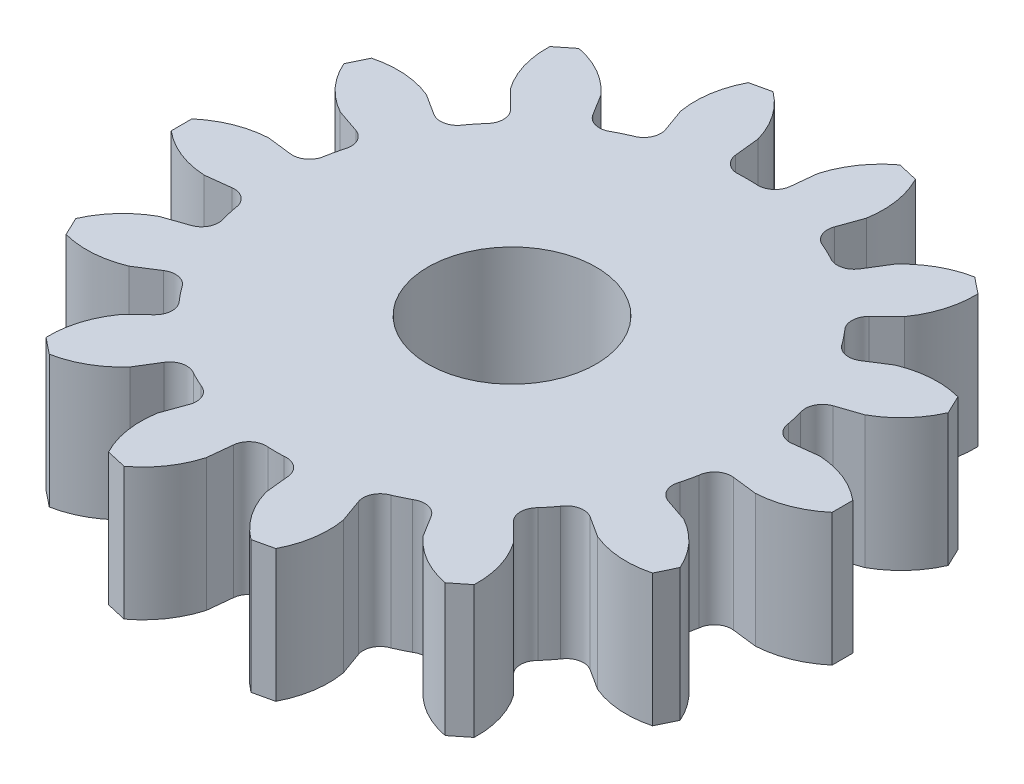
from build123d import *

# Parameters (mm, degrees)
SKETCH1_R           = 2.542419914
BOSS_EXTRUDE1_DEPTH = 3.999992


with BuildPart() as part:
    # Sketch1 → Boss-Extrude1 (new body)
    with BuildSketch(Plane(origin=(0, 0, 0), x_dir=(1, 0, 0), z_dir=(0, 1, 0))):
        with BuildLine():
            Line((-7.927115113, 2.735422797), (-7.212976361, 2.491621041))
            ThreePointArc((-7.212976361, 2.491621041), (-6.913293064, 2.224424018), (-6.895509083, 1.823315483))
            ThreePointArc((-6.895509083, 1.823315483), (-6.953671189, 1.587130072), (-7.003745952, 1.349098778))
            ThreePointArc((-7.003745952, 1.349098778), (-7.193803236, 0.995428655), (-7.579741, 0.884720165))
            Line((-7.579741, 0.884720165), (-8.3289394, 0.974915565))
            ThreePointArc((-8.3289394, 0.974915565), (-9.212212433, 0.780173764), (-9.9866958, 0.3129788))
            Line((-9.9866958, 0.3129788), (-9.9866958, -0.3129788))
            ThreePointArc((-9.9866958, -0.3129788), (-9.212212433, -0.780173764), (-8.3289394, -0.974915565))
            Line((-8.3289394, -0.974915565), (-7.579741, -0.884720165))
            ThreePointArc((-7.579741, -0.884720165), (-7.193803236, -0.995428655), (-7.003745952, -1.349098778))
            ThreePointArc((-7.003745952, -1.349098778), (-6.953671189, -1.587130072), (-6.895509083, -1.823315483))
            ThreePointArc((-6.895509083, -1.823315483), (-6.913293064, -2.224424018), (-7.212976361, -2.491621041))
            Line((-7.212976361, -2.491621041), (-7.927115113, -2.735422797))
            ThreePointArc((-7.927115113, -2.735422797), (-8.638421316, -3.294116903), (-9.133498421, -4.05108076))
            Line((-9.133498421, -4.05108076), (-8.861905597, -4.61504907))
            ThreePointArc((-8.861905597, -4.61504907), (-7.961411897, -4.699941449), (-7.081115091, -4.492159943))
            Line((-7.081115091, -4.492159943), (-6.445244975, -4.085831692))
            ThreePointArc((-6.445244975, -4.085831692), (-6.049492451, -4.018124475), (-5.724805039, -4.25430748))
            ThreePointArc((-5.724805039, -4.25430748), (-5.576411329, -4.44703964), (-5.421532073, -4.63459975))
            ThreePointArc((-5.421532073, -4.63459975), (-5.263520415, -5.003702234), (-5.417593292, -5.374466142))
            Line((-5.417593292, -5.374466142), (-5.955228458, -5.903977126))
            ThreePointArc((-5.955228458, -5.903977126), (-6.353684915, -6.715967318), (-6.471299665, -7.612774092))
            Line((-6.471299665, -7.612774092), (-5.981906306, -8.003052272))
            ThreePointArc((-5.981906306, -8.003052272), (-5.133756094, -7.688828089), (-4.430789095, -7.119676951))
            Line((-4.430789095, -7.119676951), (-4.034189136, -6.477694143))
            ThreePointArc((-4.034189136, -6.477694143), (-3.707005493, -6.244981464), (-3.311996278, -6.31689841))
            ThreePointArc((-3.311996278, -6.31689841), (-3.094674815, -6.426158468), (-2.873754145, -6.527944698))
            ThreePointArc((-2.873754145, -6.527944698), (-2.571242995, -6.791935856), (-2.54918943, -7.192832311))
            Line((-2.54918943, -7.192832311), (-2.80383577, -7.903176378))
            ThreePointArc((-2.80383577, -7.903176378), (-2.810523293, -8.807638039), (-2.527380645, -9.666664151))
            Line((-2.527380645, -9.666664151), (-1.917117109, -9.805952821))
            ThreePointArc((-1.917117109, -9.805952821), (-1.289296936, -9.154848028), (-0.902890978, -8.337054622))
            Line((-0.902890978, -8.337054622), (-0.824112663, -7.586569825))
            ThreePointArc((-0.824112663, -7.586569825), (-0.630300635, -7.234943284), (-0.243206036, -7.128350138))
            ThreePointArc((-0.243206036, -7.128350138), (0, -7.1324978), (0.243206036, -7.128350138))
            ThreePointArc((0.243206036, -7.128350138), (0.630300635, -7.234943284), (0.824112663, -7.586569825))
            Line((0.824112663, -7.586569825), (0.902890978, -8.337054622))
            ThreePointArc((0.902890978, -8.337054622), (1.289296936, -9.154848028), (1.917117109, -9.805952821))
            Line((1.917117109, -9.805952821), (2.527380645, -9.666664151))
            ThreePointArc((2.527380645, -9.666664151), (2.810523293, -8.807638039), (2.80383577, -7.903176378))
            Line((2.80383577, -7.903176378), (2.54918943, -7.192832311))
            ThreePointArc((2.54918943, -7.192832311), (2.571242995, -6.791935856), (2.873754145, -6.527944698))
            ThreePointArc((2.873754145, -6.527944698), (3.094674815, -6.426158468), (3.311996278, -6.31689841))
            ThreePointArc((3.311996278, -6.31689841), (3.707005493, -6.244981464), (4.034189136, -6.477694143))
            Line((4.034189136, -6.477694143), (4.430789095, -7.119676951))
            ThreePointArc((4.430789095, -7.119676951), (5.133756094, -7.688828089), (5.981906306, -8.003052272))
            Line((5.981906306, -8.003052272), (6.471299665, -7.612774092))
            ThreePointArc((6.471299665, -7.612774092), (6.353684915, -6.715967318), (5.955228458, -5.903977126))
            Line((5.955228458, -5.903977126), (5.417593292, -5.374466142))
            ThreePointArc((5.417593292, -5.374466142), (5.263520415, -5.003702234), (5.421532073, -4.63459975))
            ThreePointArc((5.421532073, -4.63459975), (5.576411329, -4.44703964), (5.724805039, -4.25430748))
            ThreePointArc((5.724805039, -4.25430748), (6.049492451, -4.018124475), (6.445244975, -4.085831692))
            Line((6.445244975, -4.085831692), (7.081115091, -4.492159943))
            ThreePointArc((7.081115091, -4.492159943), (7.961411897, -4.699941449), (8.861905597, -4.61504907))
            Line((8.861905597, -4.61504907), (9.133498421, -4.05108076))
            ThreePointArc((9.133498421, -4.05108076), (8.638421316, -3.294116903), (7.927115113, -2.735422797))
            Line((7.927115113, -2.735422797), (7.212976361, -2.491621041))
            ThreePointArc((7.212976361, -2.491621041), (6.913293064, -2.224424018), (6.895509083, -1.823315483))
            ThreePointArc((6.895509083, -1.823315483), (6.953671189, -1.587130072), (7.003745952, -1.349098778))
            ThreePointArc((7.003745952, -1.349098778), (7.193803236, -0.995428655), (7.579741, -0.884720165))
            Line((7.579741, -0.884720165), (8.3289394, -0.974915565))
            ThreePointArc((8.3289394, -0.974915565), (9.212212433, -0.780173764), (9.9866958, -0.3129788))
            Line((9.9866958, -0.3129788), (9.9866958, 0.3129788))
            ThreePointArc((9.9866958, 0.3129788), (9.212212433, 0.780173764), (8.3289394, 0.974915565))
            Line((8.3289394, 0.974915565), (7.579741, 0.884720165))
            ThreePointArc((7.579741, 0.884720165), (7.193803236, 0.995428655), (7.003745952, 1.349098778))
            ThreePointArc((7.003745952, 1.349098778), (6.953671189, 1.587130072), (6.895509083, 1.823315483))
            ThreePointArc((6.895509083, 1.823315483), (6.913293064, 2.224424018), (7.212976361, 2.491621041))
            Line((7.212976361, 2.491621041), (7.927115113, 2.735422797))
            ThreePointArc((7.927115113, 2.735422797), (8.638421316, 3.294116903), (9.133498421, 4.05108076))
            Line((9.133498421, 4.05108076), (8.861905597, 4.61504907))
            ThreePointArc((8.861905597, 4.61504907), (7.961411897, 4.699941449), (7.081115091, 4.492159943))
            Line((7.081115091, 4.492159943), (6.445244975, 4.085831692))
            ThreePointArc((6.445244975, 4.085831692), (6.049492451, 4.018124475), (5.724805039, 4.25430748))
            ThreePointArc((5.724805039, 4.25430748), (5.576411329, 4.44703964), (5.421532073, 4.63459975))
            ThreePointArc((5.421532073, 4.63459975), (5.263520415, 5.003702234), (5.417593292, 5.374466142))
            Line((5.417593292, 5.374466142), (5.955228458, 5.903977126))
            ThreePointArc((5.955228458, 5.903977126), (6.353684915, 6.715967318), (6.471299665, 7.612774092))
            Line((6.471299665, 7.612774092), (5.981906306, 8.003052272))
            ThreePointArc((5.981906306, 8.003052272), (5.133756094, 7.688828089), (4.430789095, 7.119676951))
            Line((4.430789095, 7.119676951), (4.034189136, 6.477694143))
            ThreePointArc((4.034189136, 6.477694143), (3.707005493, 6.244981464), (3.311996278, 6.31689841))
            ThreePointArc((3.311996278, 6.31689841), (3.094674815, 6.426158468), (2.873754145, 6.527944698))
            ThreePointArc((2.873754145, 6.527944698), (2.571242995, 6.791935856), (2.54918943, 7.192832311))
            Line((2.54918943, 7.192832311), (2.80383577, 7.903176378))
            ThreePointArc((2.80383577, 7.903176378), (2.810523293, 8.807638039), (2.527380645, 9.666664151))
            Line((2.527380645, 9.666664151), (1.917117109, 9.805952821))
            ThreePointArc((1.917117109, 9.805952821), (1.289296936, 9.154848028), (0.902890978, 8.337054622))
            Line((0.902890978, 8.337054622), (0.824112663, 7.586569825))
            ThreePointArc((0.824112663, 7.586569825), (0.630300635, 7.234943284), (0.243206036, 7.128350138))
            ThreePointArc((0.243206036, 7.128350138), (0, 7.1324978), (-0.243206036, 7.128350138))
            ThreePointArc((-0.243206036, 7.128350138), (-0.630300635, 7.234943284), (-0.824112663, 7.586569825))
            Line((-0.824112663, 7.586569825), (-0.902890978, 8.337054622))
            ThreePointArc((-0.902890978, 8.337054622), (-1.289296936, 9.154848028), (-1.917117109, 9.805952821))
            Line((-1.917117109, 9.805952821), (-2.527380645, 9.666664151))
            ThreePointArc((-2.527380645, 9.666664151), (-2.810523293, 8.807638039), (-2.80383577, 7.903176378))
            Line((-2.80383577, 7.903176378), (-2.54918943, 7.192832311))
            ThreePointArc((-2.54918943, 7.192832311), (-2.571242995, 6.791935856), (-2.873754145, 6.527944698))
            ThreePointArc((-2.873754145, 6.527944698), (-3.094674815, 6.426158468), (-3.311996278, 6.31689841))
            ThreePointArc((-3.311996278, 6.31689841), (-3.707005493, 6.244981464), (-4.034189136, 6.477694143))
            Line((-4.034189136, 6.477694143), (-4.430789095, 7.119676951))
            ThreePointArc((-4.430789095, 7.119676951), (-5.133756094, 7.688828089), (-5.981906306, 8.003052272))
            Line((-5.981906306, 8.003052272), (-6.471299665, 7.612774092))
            ThreePointArc((-6.471299665, 7.612774092), (-6.353684915, 6.715967318), (-5.955228458, 5.903977126))
            Line((-5.955228458, 5.903977126), (-5.417593292, 5.374466142))
            ThreePointArc((-5.417593292, 5.374466142), (-5.263520415, 5.003702234), (-5.421532073, 4.63459975))
            ThreePointArc((-5.421532073, 4.63459975), (-5.576411329, 4.44703964), (-5.724805039, 4.25430748))
            ThreePointArc((-5.724805039, 4.25430748), (-6.049492451, 4.018124475), (-6.445244975, 4.085831692))
            Line((-6.445244975, 4.085831692), (-7.081115091, 4.492159943))
            ThreePointArc((-7.081115091, 4.492159943), (-7.961411897, 4.699941449), (-8.861905597, 4.61504907))
            Line((-8.861905597, 4.61504907), (-9.133498421, 4.05108076))
            ThreePointArc((-9.133498421, 4.05108076), (-8.638421316, 3.294116903), (-7.927115113, 2.735422797))
        make_face()
        with Locations(Location((0, 0, 0), (0, 0, 270))):
            Circle(SKETCH1_R, mode=Mode.SUBTRACT)
    extrude(amount=BOSS_EXTRUDE1_DEPTH)


solid = part.part
